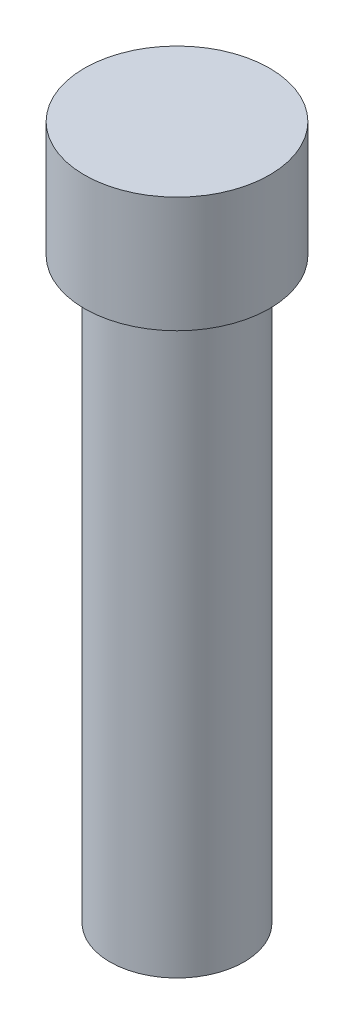
from build123d import *

# Parameters (mm, degrees)
SKETCH_1_R      = 2.9
EXTRUDE_1_DEPTH = 25
SKETCH_2_R      = 4
EXTRUDE_2_DEPTH = 5


with BuildPart() as part:
    # 草图1 → 凸台-拉伸1 (new body)
    with BuildSketch(Plane(origin=(0, 0, 0), x_dir=(1, 0, 0), z_dir=(0, 1, 0))):
        with Locations(Location((0, 0, 0), (0, 0, 270))):
            Circle(SKETCH_1_R)
    extrude(amount=EXTRUDE_1_DEPTH)

    # 草图2 → 凸台-拉伸2 (add)
    with BuildSketch(Plane(origin=(0, 25, 0), x_dir=(1, 0, 0), z_dir=(0, 1, 0))):
        with Locations(Location((0, 0, 0), (0, 0, 270))):
            Circle(SKETCH_2_R)
    extrude(amount=EXTRUDE_2_DEPTH)


solid = part.part
